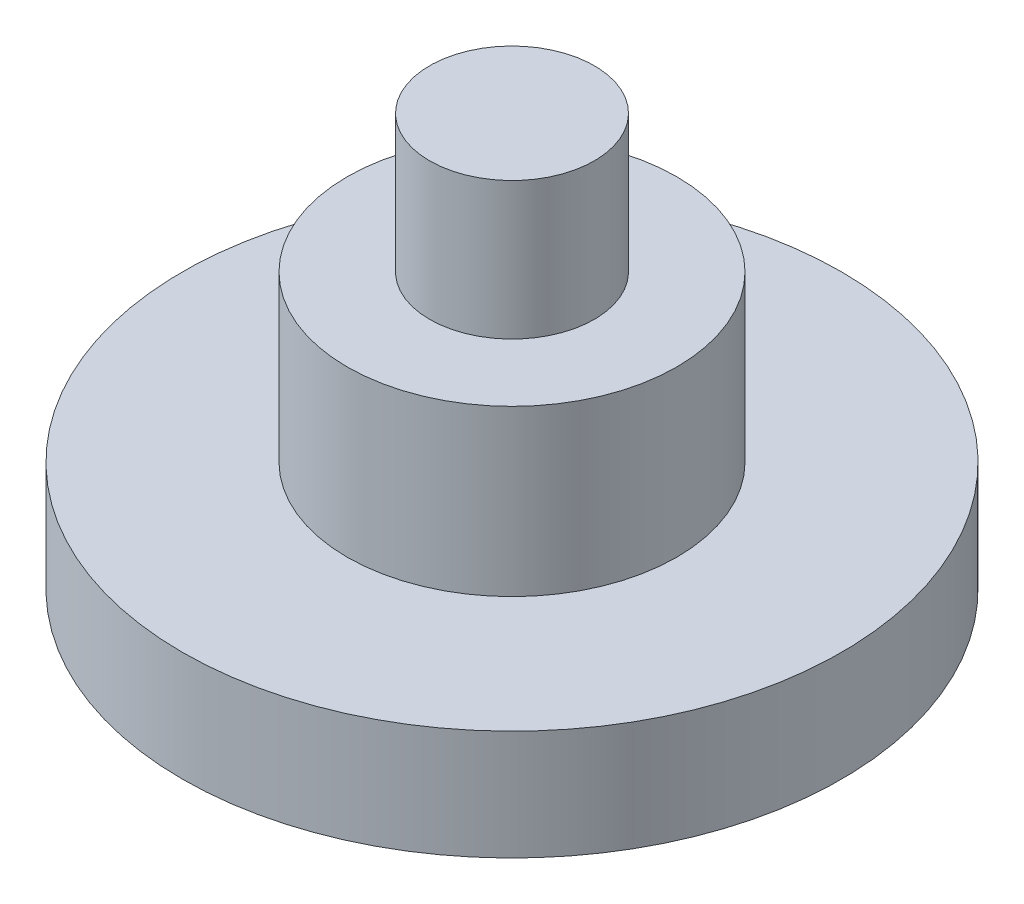
from build123d import *

# Parameters (mm, degrees)
SKETCH1_R           = 60
BOSS_EXTRUDE1_DEPTH = 20
SKETCH2_R           = 30
BOSS_EXTRUDE2_DEPTH = 30
SKETCH3_R           = 15
BOSS_EXTRUDE3_DEPTH = 25


with BuildPart() as part:
    # Sketch1 → Boss-Extrude1 (new body)
    with BuildSketch(Plane(origin=(0, 0, 0), x_dir=(1, 0, 0), z_dir=(0, 1, 0))):
        with Locations(Location((0, 0, 0), (0, 0, 270))):
            Circle(SKETCH1_R)
    extrude(amount=BOSS_EXTRUDE1_DEPTH)

    # Sketch2 → Boss-Extrude2 (add)
    with BuildSketch(Plane(origin=(0, 20, 0), x_dir=(1, 0, 0), z_dir=(0, 1, 0))):
        with Locations(Location((0, 0, 0), (0, 0, 270))):
            Circle(SKETCH2_R)
    extrude(amount=BOSS_EXTRUDE2_DEPTH)

    # Sketch3 → Boss-Extrude3 (add)
    with BuildSketch(Plane(origin=(0, 50, 0), x_dir=(1, 0, 0), z_dir=(0, 1, 0))):
        with Locations(Location((0, 0, 0), (0, 0, 270))):
            Circle(SKETCH3_R)
    extrude(amount=BOSS_EXTRUDE3_DEPTH)


solid = part.part
